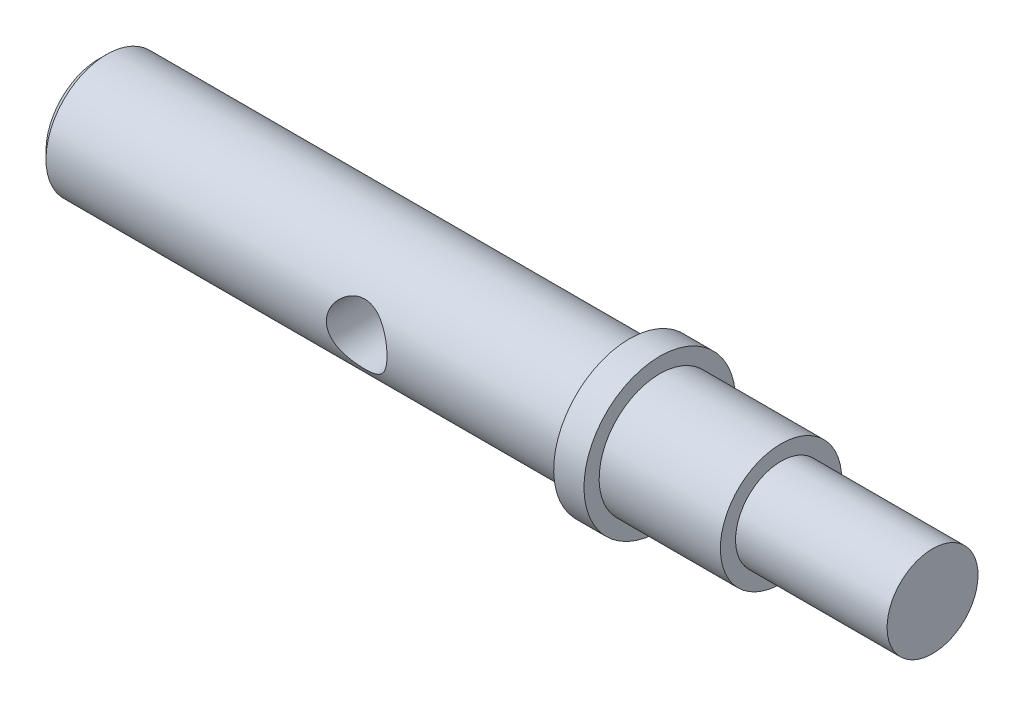
from build123d import *

# Parameters (mm, degrees)
CUT_EXTRUDE_START   = -3.5
CUT_EXTRUDE_1_DEPTH = 10
SKETCH_3_W          = 4
SKETCH_3_H          = 19.670556204
CUT_EXTRUDE_2_DEPTH = 10
CUT_EXTRUDE_START_2 = -29
SKETCH_4_R          = 4
SKETCH_4_R_2        = 2
CUT_EXTRUDE_3_DEPTH = 29
SKETCH_5_R          = 1
CUT_EXTRUDE_4_DEPTH = 5
SKETCH_6_R          = 2
EXTRUDE_1_DEPTH     = 1
EXTRUDE_START       = -4.5
SKETCH_7_R          = 2.5
SKETCH_7_R_2        = 2
EXTRUDE_2_DEPTH     = 1
CHAMFER_2_SIZE      = 0.25
SKETCH_8_R          = 2
EXTRUDE_3_DEPTH     = 0.5
SKETCH_11_R         = 1.5
EXTRUDE_4_DEPTH     = 5


with BuildPart() as part:
    # 草图1 → 旋转2 (revolve)
    with BuildSketch(Plane.XY, mode=Mode.PRIVATE) as revolve_2_sk:
        Polygon((0, 2), (0, 0), (17, 0), (21, 0), (21, 2), (17, 2), (17, 4), (4, 4), (4, 2), align=None)
    revolve(revolve_2_sk.sketch.rotate(Axis((-16.701754386, 0, 0), (1, 0, 0)), 180), axis=Axis((-16.701754386, 0, 0), (1, 0, 0)))

    # 草图2 → 切除-拉伸1 (cut)
    with BuildSketch(Plane.XY.offset(CUT_EXTRUDE_START)):
        Polygon((12.5, -5.827233832), (12.5, 4), (10.5, 4), (8.5, 4), (8.5, -5.827233832), align=None)
    extrude(amount=-CUT_EXTRUDE_1_DEPTH, mode=Mode.SUBTRACT)

    # 草图3 → 切除-拉伸2 (cut)
    with BuildSketch(Plane(origin=(0, 0, 0), x_dir=(1, 0, 0), z_dir=(0, 1, 0)).offset(CUT_EXTRUDE_START)):
        with Locations((10.5, 3.5)):
            Rectangle(SKETCH_3_W, SKETCH_3_H)
    extrude(amount=-CUT_EXTRUDE_2_DEPTH, mode=Mode.SUBTRACT)

    # 草图4 → 切除-拉伸3 (cut)
    with BuildSketch(Plane(origin=(21, 0, 0), x_dir=(0, 0, -1), z_dir=(1, 0, 0)).offset(CUT_EXTRUDE_START_2)):
        Circle(SKETCH_4_R)
        with Locations(Location((0, 0, 0), (0, 0, 270))):
            Circle(SKETCH_4_R_2, mode=Mode.SUBTRACT)
    extrude(amount=CUT_EXTRUDE_3_DEPTH, mode=Mode.SUBTRACT)

    # 草图5 → 切除-拉伸4 (cut, symmetric)
    with BuildSketch(Plane.XY):
        with Locations((10.5, 0)):
            Circle(SKETCH_5_R)
    extrude(amount=CUT_EXTRUDE_4_DEPTH, both=True, mode=Mode.SUBTRACT)

    # 草图6 → 凸台-拉伸1 (add)
    with BuildSketch(Plane(origin=(21, 0, 0), x_dir=(0, 0, -1), z_dir=(1, 0, 0))):
        with Locations(Location((0, 0, 0), (0, 0, 270))):
            Circle(SKETCH_6_R)
    extrude(amount=EXTRUDE_1_DEPTH)

    # 草图7 → 凸台-拉伸2 (add)
    with BuildSketch(Plane(origin=(22, 0, 0), x_dir=(0, 0, -1), z_dir=(1, 0, 0)).offset(EXTRUDE_START)):
        with Locations(Location((0, 0, 0), (0, 0, 90))):
            Circle(SKETCH_7_R)
        with Locations(Location((0, 0, 0), (0, 0, 270))):
            Circle(SKETCH_7_R_2, mode=Mode.SUBTRACT)
    extrude(amount=EXTRUDE_2_DEPTH)

    # 倒角2
    chamfer_2_edges = [part.edges().sort_by_distance(p)[0] for p in [
        (0, 2, 0),
    ]]
    chamfer(chamfer_2_edges, length=CHAMFER_2_SIZE)

    # 草图8 → 凸台-拉伸3 (add)
    with BuildSketch(Plane(origin=(22, 0, 0), x_dir=(0, 0, -1), z_dir=(1, 0, 0))):
        with Locations(Location((0, 0, 0), (0, 0, 270))):
            Circle(SKETCH_8_R)
    extrude(amount=EXTRUDE_3_DEPTH)

    # 草图11 → 凸台-拉伸4 (add)
    with BuildSketch(Plane(origin=(22.5, 0, 0), x_dir=(0, 0, -1), z_dir=(1, 0, 0))):
        with Locations(Location((0, 0, 0), (0, 0, 90))):
            Circle(SKETCH_11_R)
    extrude(amount=EXTRUDE_4_DEPTH)


solid = part.part
